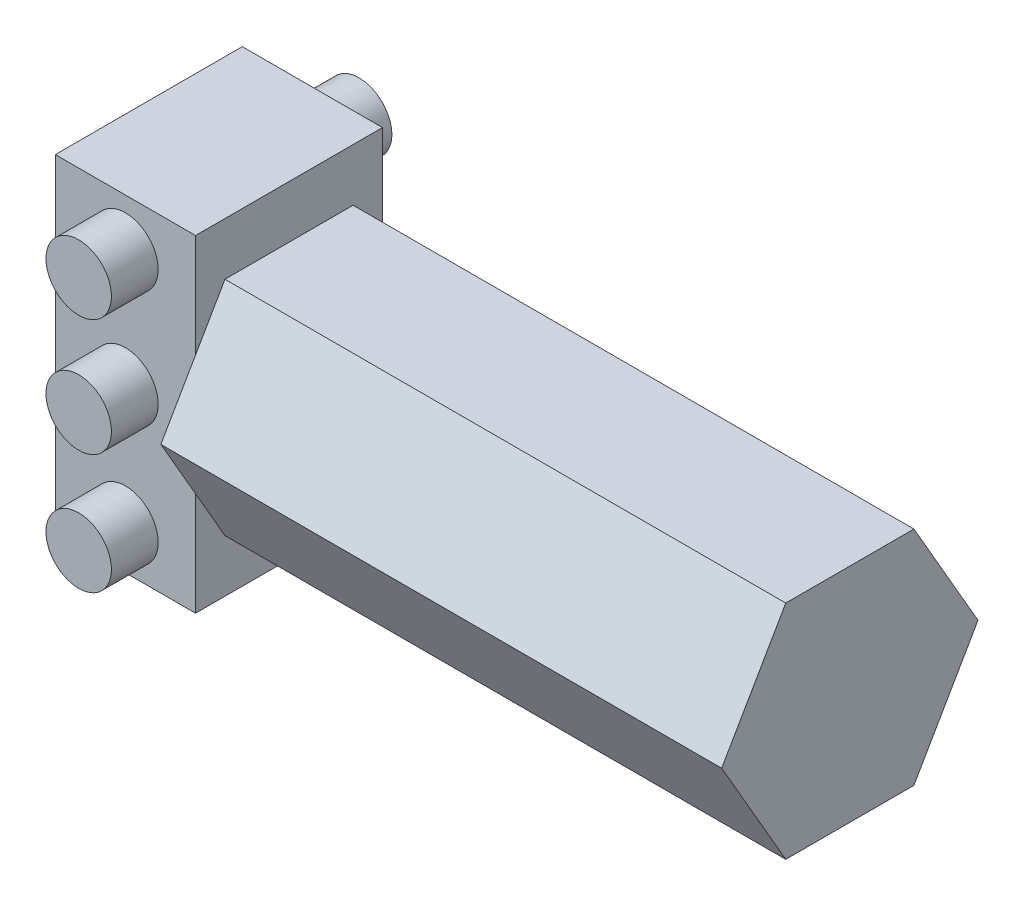
from build123d import *

# Parameters (mm, degrees)
SKETCH2_W           = 7.62
SKETCH2_H           = 17.78
BOSS_EXTRUDE1_DEPTH = 10.16
BOSS_EXTRUDE3_DEPTH = 30.48
SKETCH8_R           = 1.778
SKETCH8_R_2         = 1.721357936
BOSS_EXTRUDE4_DEPTH = 2.54
BOSS_EXTRUDE5_START = 2.54
SKETCH6_R           = 1.778
BOSS_EXTRUDE5_DEPTH = 2.54


with BuildPart() as part:
    # Sketch2 → Boss-Extrude1 (new body)
    with BuildSketch(Plane.XY):
        with Locations((3.81, 8.89)):
            Rectangle(SKETCH2_W, SKETCH2_H)
    extrude(amount=BOSS_EXTRUDE1_DEPTH)

    # Sketch3 → Boss-Extrude3 (add)
    with BuildSketch(Plane(origin=(7.62, 0, 0), x_dir=(0, 0, -1), z_dir=(1, 0, 0))):
        Polygon((1.885696, 8.89), (-1.597152, 14.922469691), (-8.562848, 14.922469691), (-12.045696, 8.89), (-8.562848, 2.857530309), (-1.597152, 2.857530309), align=None)
    extrude(amount=BOSS_EXTRUDE3_DEPTH)

    # Sketch8 → Boss-Extrude4 (add)
    with BuildSketch(Plane(origin=(0, 0, 0), x_dir=(-1, 0, 0), z_dir=(0, 0, -1))):
        with Locations((-3.81, 15.167140335)):
            Circle(SKETCH8_R)
        with Locations((-3.81, 8.817140335)):
            Circle(SKETCH8_R)
        with Locations((-3.81, 2.31394822)):
            Circle(SKETCH8_R_2)
    extrude(amount=BOSS_EXTRUDE4_DEPTH)

    # Sketch6 → Boss-Extrude5 (add)
    with BuildSketch(Plane.XY.offset(10.16).offset(BOSS_EXTRUDE5_START)):
        with Locations(Location((3.81, 15.167140335, 0), (0, 0, 180))):
            Circle(SKETCH6_R)
        with Locations(Location((3.81, 8.817140335, 0), (0, 0, 180))):
            Circle(SKETCH6_R)
        with Locations(Location((3.81, 2.31394822, 0), (0, 0, 180))):
            Circle(SKETCH6_R)
    extrude(amount=-BOSS_EXTRUDE5_DEPTH)


solid = part.part
